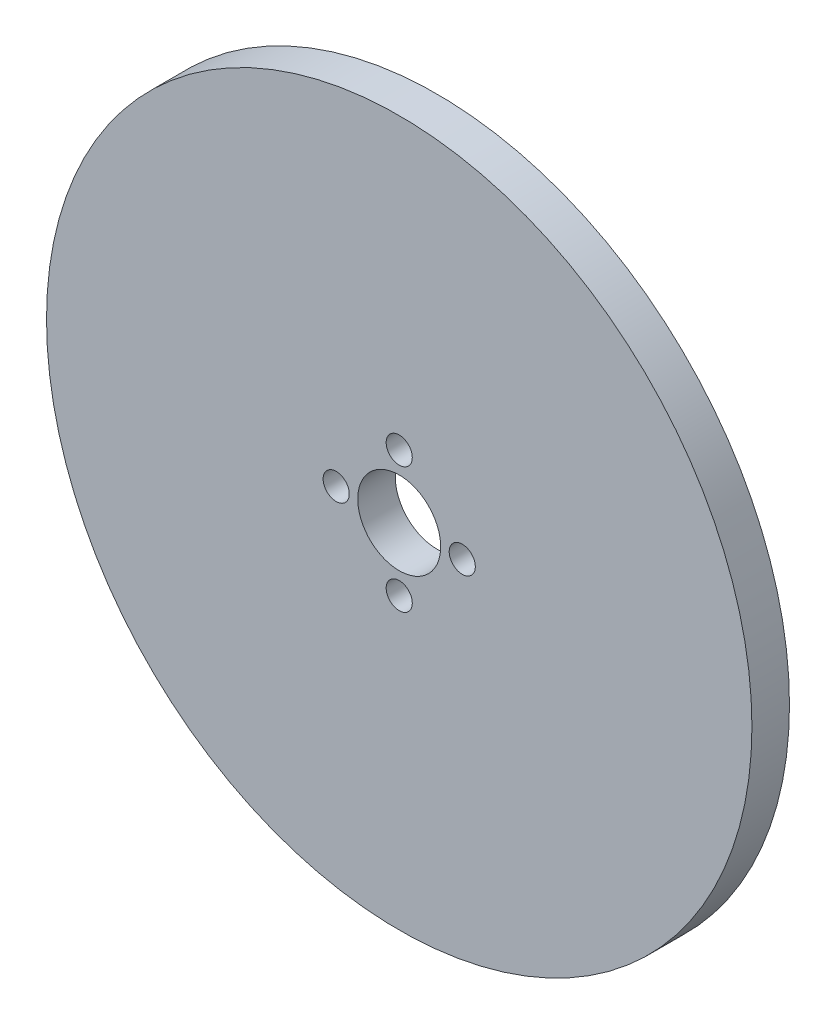
from build123d import *

# Parameters (mm, degrees)
ESQUISSE1_R        = 54
ESQUISSE1_R_2      = 2
ESQUISSE1_R_3      = 3.175
BOSS_EXTRU_1_DEPTH = 5.75
CUT_EXTRUDE1_REACH = 78.584
SKETCH1_R          = 6.35


with BuildPart() as part:
    # Esquisse1 → Boss.-Extru.1 (new body)
    with BuildSketch(Plane.XY):
        Circle(ESQUISSE1_R)
        with Locations((0, -9.65)):
            Circle(ESQUISSE1_R_2, mode=Mode.SUBTRACT)
        with Locations((0, 9.65)):
            Circle(ESQUISSE1_R_2, mode=Mode.SUBTRACT)
        with Locations((-9.65, 0)):
            Circle(ESQUISSE1_R_2, mode=Mode.SUBTRACT)
        with Locations((9.65, 0)):
            Circle(ESQUISSE1_R_2, mode=Mode.SUBTRACT)
        Circle(ESQUISSE1_R_3, mode=Mode.SUBTRACT)
    extrude(amount=-BOSS_EXTRU_1_DEPTH)

    # Sketch1 → Cut-Extrude1 (cut, up to next)
    with BuildSketch(Plane(origin=(0, 0, -5.75), x_dir=(-1, 0, 0), z_dir=(0, 0, -1)), mode=Mode.PRIVATE) as cut_extrude1_sk1:
        Circle(SKETCH1_R)
    cut_extrude1_tool1 = extrude(cut_extrude1_sk1.sketch, amount=-CUT_EXTRUDE1_REACH, mode=Mode.PRIVATE) & part.part
    add(cut_extrude1_tool1.solids().sort_by_distance((0, 0, -5.75))[0], mode=Mode.SUBTRACT)


solid = part.part
